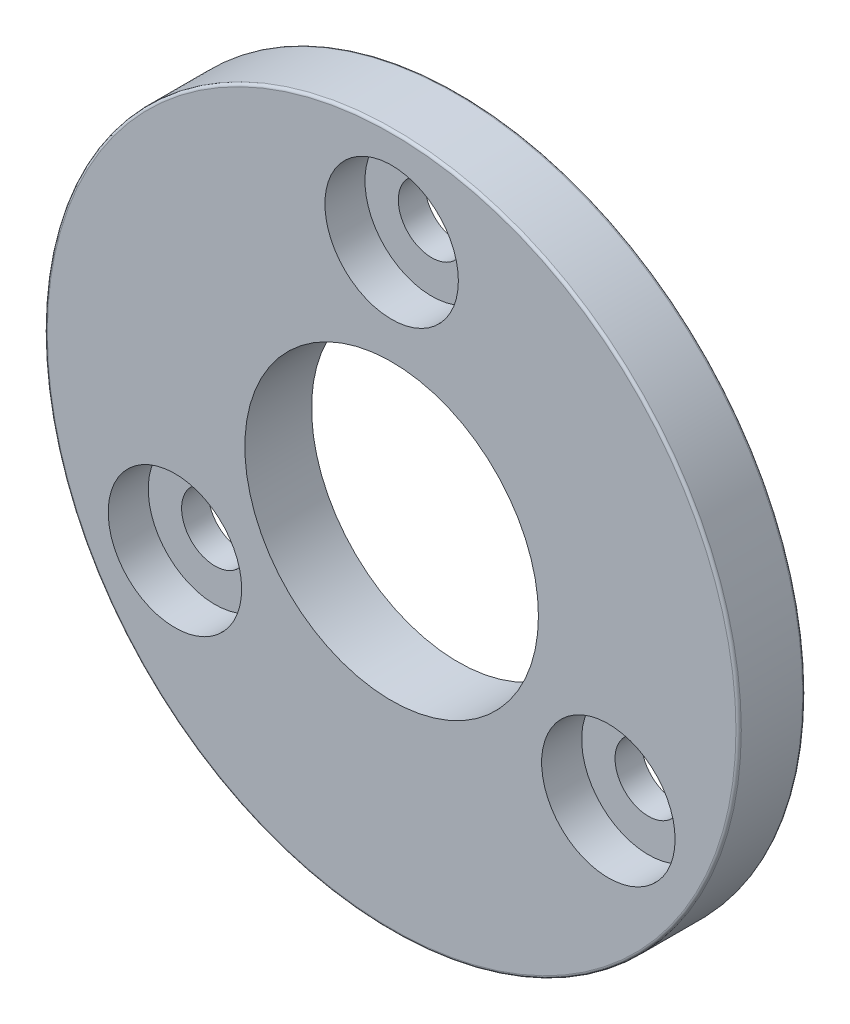
from build123d import *

# Parameters (mm, degrees)
SKETCH1_R            = 26
BOSS_EXTRUDE1_DEPTH  = 5
M5_CLEARANCE_HOLE1_D = 5
CIRPATTERN1_COUNT    = 3
SKETCH4_R            = 11
CUT_EXTRUDE1_DEPTH   = 5
FILLET1_R            = 0.2
SKETCH5_R            = 5
CUT_EXTRUDE2_DEPTH   = 3


with BuildPart() as part:
    # Sketch1 → Boss-Extrude1 (new body)
    with BuildSketch(Plane.XY):
        Circle(SKETCH1_R)
    extrude(amount=BOSS_EXTRUDE1_DEPTH)

    # M5 Clearance Hole1 (through all)
    with Locations(Plane.XY.offset(5)):
        with Locations((0, 18.75)):
            m5_clearance_hole1 = Hole(M5_CLEARANCE_HOLE1_D / 2)

    # CirPattern1: M5 Clearance Hole1 ×3 about axis
    cirpattern1_axis = Axis((0, 0, 0), (0, 0, 1))
    for i in range(1, CIRPATTERN1_COUNT):
        add(m5_clearance_hole1.rotate(cirpattern1_axis, i * 360 / CIRPATTERN1_COUNT), mode=Mode.SUBTRACT)

    # Sketch4 → Cut-Extrude1 (cut)
    with BuildSketch(Plane.XY.offset(5)):
        Circle(SKETCH4_R)
    extrude(amount=-CUT_EXTRUDE1_DEPTH, mode=Mode.SUBTRACT)

    # Fillet1
    fillet1_edges = [part.edges().sort_by_distance(p)[0] for p in [
        (-26, 0, 0),
        (-26, 0, 5),
    ]]
    fillet(fillet1_edges, radius=FILLET1_R)

    # Sketch5 → Cut-Extrude2 (cut)
    with BuildSketch(Plane.XY.offset(5)):
        with Locations((0, 18.75)):
            Circle(SKETCH5_R)
        with Locations((-16.237976321, -9.375)):
            Circle(SKETCH5_R)
        with Locations((16.237976321, -9.375)):
            Circle(SKETCH5_R)
    extrude(amount=-CUT_EXTRUDE2_DEPTH, mode=Mode.SUBTRACT)


solid = part.part
